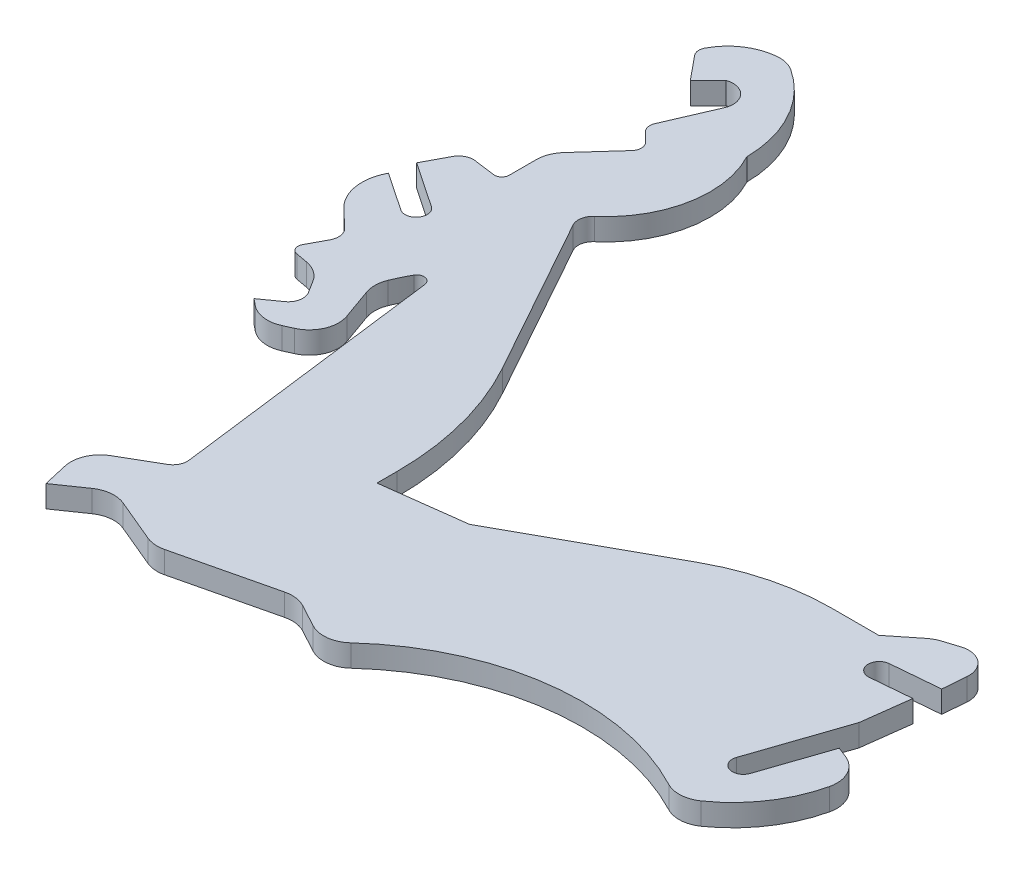
from build123d import *

# Parameters (mm, degrees)
BOSS_EXTRUDE2_DEPTH = 3
FILLET1_R           = 1
FILLET2_R           = 4
FILLET3_R           = 40
FILLET4_R           = 2
FILLET5_R           = 1.4
FILLET6_R           = 30
FILLET7_R           = 3
FILLET8_R           = 6


with BuildPart() as part:
    # Sketch4 → Boss-Extrude2 (new body)
    with BuildSketch(Plane(origin=(0, 0, 0), x_dir=(1, 0, 0), z_dir=(0, 1, 0))):
        with BuildLine():
            Line((87.31, 79.61), (91.618486592, 77.887634392))
            ThreePointArc((91.618486592, 77.887634392), (88.863922918, 68.889748023), (81.855760182, 62.61))
            ThreePointArc((81.855760182, 62.61), (59.656820918, 67.258748235), (39.555721251, 56.754008505))
            Line((39.555721251, 56.754008505), (32.499176634, 60.570465889))
            Line((32.499176634, 60.570465889), (16.517315238, 56.754008505))
            Line((16.517315238, 56.754008505), (7.414760931, 60.570465889))
            Line((7.414760931, 60.570465889), (1.892511031, 56.754008505))
            Line((1.892511031, 56.754008505), (0.46321022, 62.992365596))
            Line((0.46321022, 62.992365596), (9.066007765, 67.967785451))
            Line((9.066007765, 67.967785451), (3.879350061, 108.84040305))
            ThreePointArc((3.879350061, 108.84040305), (2.01611376, 105.85998951), (0.66321022, 102.615892348))
            Line((0.66321022, 102.615892348), (3.879350061, 93.591357519))
            Line((3.879350061, 93.591357519), (-2.93678978, 90.505813501))
            Line((-2.93678978, 90.505813501), (-5.768910997, 92.808331559))
            Line((-5.768910997, 92.808331559), (-1.778138145, 95.640627614))
            Line((-1.778138145, 95.640627614), (-4.765318246, 100.408264948))
            Line((-4.765318246, 100.408264948), (-9.496065378, 101.269350579))
            Line((-9.496065378, 101.269350579), (-6.815233616, 106.290541956))
            Line((-6.815233616, 106.290541956), (-13.555482626, 112.676963609))
            Line((-13.555482626, 112.676963609), (-11.418327461, 116.805813501))
            Line((-11.418327461, 116.805813501), (-6.221647651, 113.305813501))
            ThreePointArc((-6.221647651, 113.305813501), (-4.139581192, 113.712014511), (-4.545782202, 115.79408097))
            Line((-4.545782202, 115.79408097), (-10.724979751, 119.955813501))
            Line((-10.724979751, 119.955813501), (-8.365992616, 124.387469749))
            Line((-8.365992616, 124.387469749), (-2.93678978, 123.666991194))
            Line((-2.93678978, 123.666991194), (-2.93678978, 130.055848545))
            Line((-2.93678978, 130.055848545), (3.413077147, 137.08559026))
            Line((3.413077147, 137.08559026), (0.522809133, 139.95641446))
            Line((0.522809133, 139.95641446), (3.698074275, 147.318161123))
            ThreePointArc((3.698074275, 147.318161123), (3.364070449, 150.092913281), (0.66321022, 150.811357519))
            Line((0.66321022, 150.811357519), (-1.778138145, 148.370009154))
            Line((-1.778138145, 148.370009154), (-4.999762187, 152.301948586))
            ThreePointArc((-4.999762187, 152.301948586), (-1.941119995, 156.054428227), (2.78321022, 157.111357519))
            ThreePointArc((2.78321022, 157.111357519), (8.815996079, 151.282158066), (11.096791577, 143.209237691))
            ThreePointArc((11.096791577, 143.209237691), (12.311774437, 133.113784868), (6.46321022, 124.795813501))
            Line((6.46321022, 124.795813501), (24.42321022, 92.530161433))
            Line((24.42321022, 92.530161433), (24.42321022, 79.395813501))
            Line((24.42321022, 79.395813501), (35.622369927, 80.833234121))
            Line((35.622369927, 80.833234121), (62.451437904, 95.640627614))
            Line((62.451437904, 95.640627614), (76.661791259, 95.640627614))
            Line((76.661791259, 95.640627614), (80.884676882, 99.013707758))
            Line((80.884676882, 99.013707758), (87.938365698, 101.231357519))
            Line((87.938365698, 101.231357519), (87.31, 93.591357519))
            Line((87.31, 93.591357519), (80.722672152, 93.01504101))
            ThreePointArc((80.722672152, 93.01504101), (79.359113719, 91.390015348), (80.984139381, 90.026456915))
            Line((80.984139381, 90.026456915), (86.46321022, 90.505813501))
            Line((86.46321022, 90.505813501), (85.632866314, 84))
            Line((85.632866314, 84), (81.389705108, 71.508585308))
            ThreePointArc((81.389705108, 71.508585308), (82.327545423, 69.605835839), (84.230294892, 70.543676154))
            Line((84.230294892, 70.543676154), (87.31, 79.61))
        make_face()
    extrude(amount=BOSS_EXTRUDE2_DEPTH)

    # Fillet1
    fillet1_edges = [part.edges().sort_by_distance(p)[0] for p in [
        (3.879350061, 1.5, -108.84040305),
        (-9.496065378, 1.5, -101.269350579),
        (-2.93678978, 1.5, -123.666991194),
    ]]
    fillet(fillet1_edges, radius=FILLET1_R)

    # Fillet2
    fillet2_edges = [part.edges().sort_by_distance(p)[0] for p in [
        (39.555721251, 1.5, -56.754008505),
        (32.499176634, 1.5, -60.570465889),
        (16.517315238, 1.5, -56.754008505),
        (7.414760931, 1.5, -60.570465889),
        (0.46321022, 1.5, -62.992365596),
        (0.66321022, 1.5, -102.615892348),
        (3.879350061, 1.5, -93.591357519),
        (-2.93678978, 1.5, -90.505813501),
        (-4.765318246, 1.5, -100.408264948),
        (-2.93678978, 1.5, -130.055848545),
        (2.78321022, 1.5, -157.111357519),
        (80.884676882, 1.5, -99.013707758),
        (91.618486592, 1.5, -77.887634392),
        (81.855760182, 1.5, -62.61),
    ]]
    fillet(fillet2_edges, radius=FILLET2_R)

    # Fillet3
    fillet3_edges = [part.edges().sort_by_distance(p)[0] for p in [
        (24.42321022, 1.5, -92.530161433),
    ]]
    fillet(fillet3_edges, radius=FILLET3_R)

    # Fillet4
    fillet4_edges = [part.edges().sort_by_distance(p)[0] for p in [
        (9.066007765, 1.5, -67.967785451),
        (-1.778138145, 1.5, -95.640627614),
        (-6.815233616, 1.5, -106.290541956),
        (-8.365992616, 1.5, -124.387469749),
        (6.46321022, 1.5, -124.795813501),
    ]]
    fillet(fillet4_edges, radius=FILLET4_R)

    # Fillet5
    fillet5_edges = [part.edges().sort_by_distance(p)[0] for p in [
        (3.413077147, 1.5, -137.08559026),
        (0.522809133, 1.5, -139.95641446),
        (-4.999762187, 1.5, -152.301948586),
    ]]
    fillet(fillet5_edges, radius=FILLET5_R)

    # Fillet6
    fillet6_edges = [part.edges().sort_by_distance(p)[0] for p in [
        (62.451437904, 1.5, -95.640627614),
    ]]
    fillet(fillet6_edges, radius=FILLET6_R)

    # Fillet7
    fillet7_edges = [part.edges().sort_by_distance(p)[0] for p in [
        (87.938365698, 1.5, -101.231357519),
    ]]
    fillet(fillet7_edges, radius=FILLET7_R)

    # Fillet8
    fillet8_edges = [part.edges().sort_by_distance(p)[0] for p in [
        (-13.555482626, 1.5, -112.676963609),
    ]]
    fillet(fillet8_edges, radius=FILLET8_R)


solid = part.part
